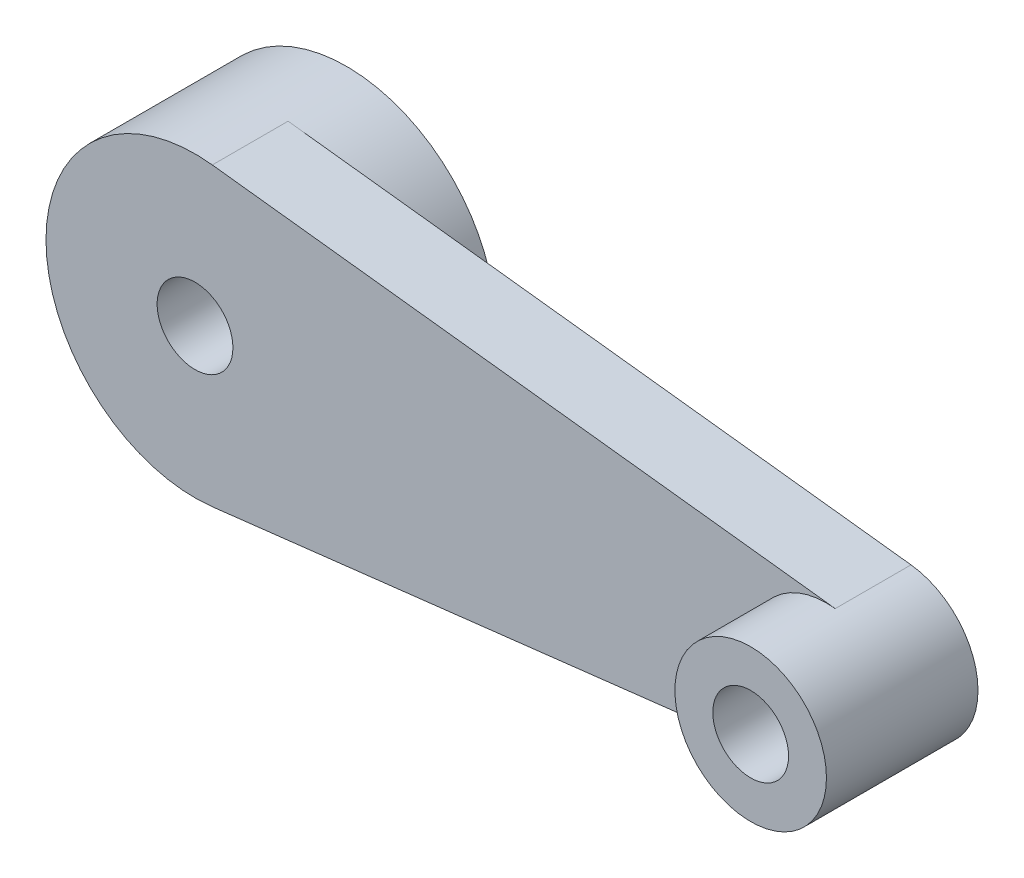
from build123d import *
from build123d.topology import SkipClean

# Parameters (mm, degrees)
CORTE_R                 = 1.5
SALIENTE_EXTRUIR1_DEPTH = 3
SALIENTE_EXTRUIR2_START = -3
EXT1_R                  = 5.9
EXT1_R_2                = 2.75
SALIENTE_EXTRUIR2_DEPTH = 3
EXT2_R                  = 3
EXT2_R_2                = 1.5
SALIENTE_EXTRUIR3_DEPTH = 6


with BuildPart() as part:
    # Corte → Saliente-Extruir1 (new body)
    with BuildSketch(Plane.XY):
        with BuildLine():
            Line((35.929130783, 45.505192832), (60.592730783, 42.624770113))
            ThreePointArc((60.592730783, 42.624770113), (63.244730783, 39.645022473), (60.592730783, 36.665274833))
            Line((60.592730783, 36.665274833), (35.929130783, 33.784852114))
            ThreePointArc((35.929130783, 33.784852114), (29.344730783, 39.645022473), (35.929130783, 45.505192832))
        make_face()
        with Locations((35.244730783, 39.645022473)):
            Circle(CORTE_R, mode=Mode.SUBTRACT)
        with Locations((60.244730783, 39.645022473)):
            Circle(CORTE_R, mode=Mode.SUBTRACT)
    extrude(amount=SALIENTE_EXTRUIR1_DEPTH)

    # Ext1 → Saliente-Extruir2 (add)
    with SkipClean():  # the faces are left unmerged after this step: merging them gives an invalid solid
        with BuildSketch(Plane.XY.offset(SALIENTE_EXTRUIR2_START)):
            with Locations(Location((35.244730783, 39.645022473, 0), (0, 0, 83.338693133))):
                Circle(EXT1_R)
            with Locations((35.244730783, 39.645022473)):
                Circle(EXT1_R_2, mode=Mode.SUBTRACT)
        extrude(amount=SALIENTE_EXTRUIR2_DEPTH)

    # Ext2 → Saliente-Extruir3 (add)
    with SkipClean():  # the faces are left unmerged after this step: merging them gives an invalid solid
        with BuildSketch(Plane.XY):
            with Locations(Location((60.244730783, 39.645022473, 0), (0, 0, 83.338693133))):
                Circle(EXT2_R)
            with Locations((60.244730783, 39.645022473)):
                Circle(EXT2_R_2, mode=Mode.SUBTRACT)
        extrude(amount=SALIENTE_EXTRUIR3_DEPTH)


solid = part.part
